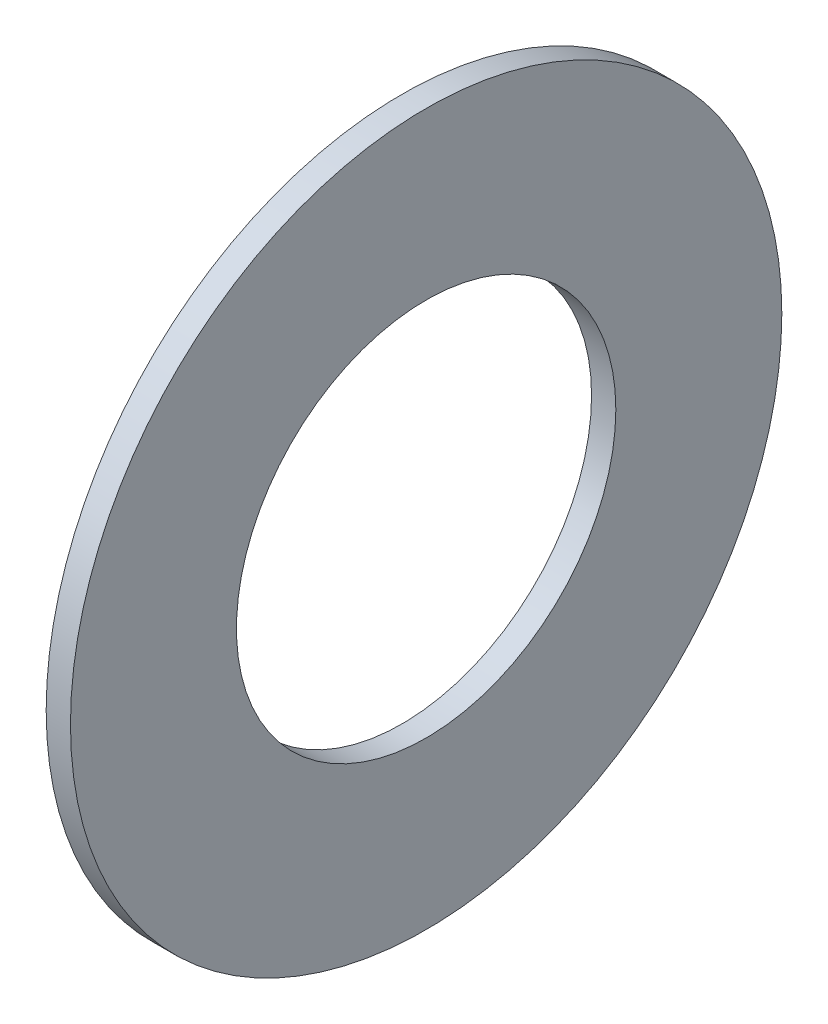
from build123d import *

# Parameters (mm, degrees)
SKETCH1_R      = 11.90625
SKETCH1_R_2    = 6.35
EXTRUDE1_DEPTH = 0.8128


with BuildPart() as part:
    # Sketch1 → Extrude1 (new body)
    with BuildSketch(Plane(origin=(0, 0, 0), x_dir=(0, 0, -1), z_dir=(1, 0, 0))):
        Circle(SKETCH1_R)
        Circle(SKETCH1_R_2, mode=Mode.SUBTRACT)
    extrude(amount=EXTRUDE1_DEPTH)


solid = part.part
